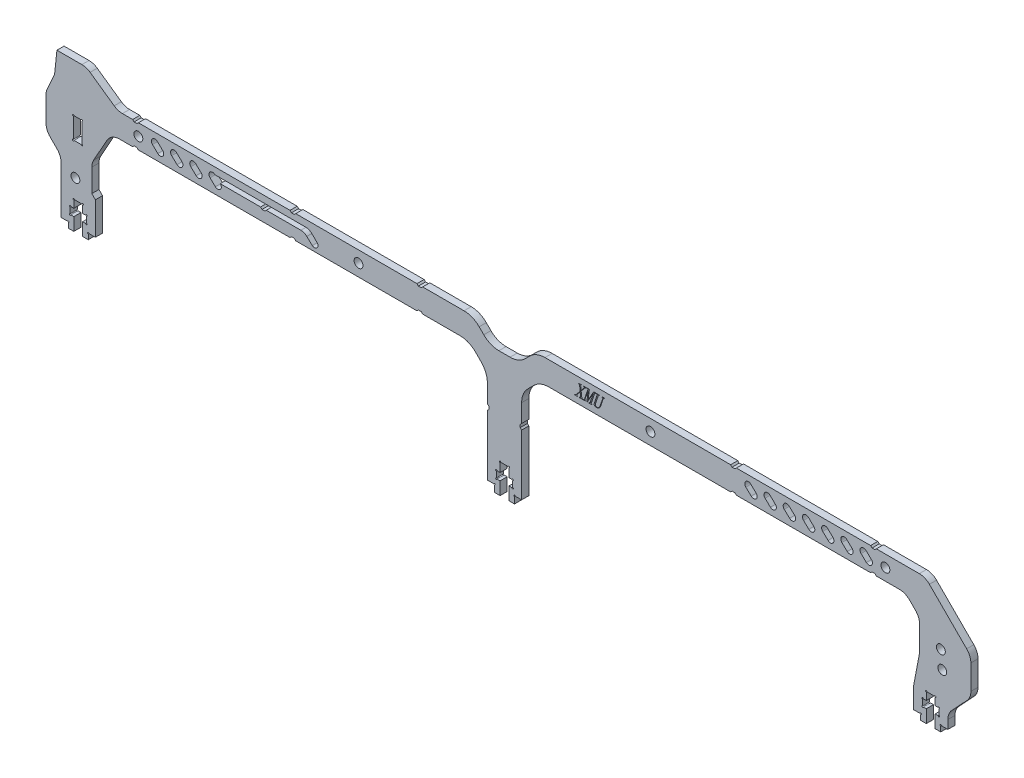
from build123d import *

# Parameters (mm, degrees)
SKETCH_1_R             = 1.55
EXTRUDE_1_DEPTH        = 2.5
CUT_EXTRUDE_START      = 2.5
CUT_EXTRUDE_3496_DEPTH = 174.669400478
SKETCH_5_R             = 1.55
CUT_EXTRUDE_4025_DEPTH = 172.169400478
CUT_EXTRUDE_3_DEPTH    = 172.169400478
SKETCH_4_R             = 1.55
SKETCH_4_W             = 3
SKETCH_4_H             = 7.5
CUT_EXTRUDE_5593_DEPTH = 172.169400605
FILLET_2_R             = 5
FILLET_3_R             = 7.5
SKETCH_6_R             = 0.25
CUT_EXTRUDE_7978_DEPTH = 172.169400605


with BuildPart() as part:
    # 草图1 → 凸台-拉伸1 (new body)
    with BuildSketch(Plane.XY):
        Polygon((6, -16.169651978), (6, -48.75), (3.5, -48.75), (3.5, -51.25), (1.55, -51.25), (1.55, -46.75), (2.85, -46.75), (2.85, -44.25), (1.55, -44.25), (1.55, -41), (-1.55, -41), (-1.55, -44.25), (-2.85, -44.25), (-2.85, -46.75), (-1.55, -46.75), (-1.55, -51.25), (-3.5, -51.25), (-3.5, -48.75), (-6, -48.75), (-6, -16.169651978), (-12.419651978, -9.75), (-137.776793554, -9.75), (-144.5, -21.790224422), (-144.5, -31.126984908), (-143.25, -32.372551033), (-143.25, -43.75), (-145.75, -43.75), (-145.75, -45.75), (-147.7, -45.75), (-147.7, -41.25), (-146.4, -41.25), (-146.4, -38.75), (-147.7, -38.75), (-147.7, -36), (-150.8, -36), (-150.8, -38.75), (-152.1, -38.75), (-152.1, -41.25), (-150.8, -41.25), (-150.8, -45.75), (-152.75, -45.75), (-152.75, -43.75), (-155.25, -43.75), (-155.25, -25.087295918), (-160.547038302, -19.809046738), (-160.547038302, -8.191202609), (-157.535079808, -1.5), (-156.72406497, 6.25), (-146.4, 6.25), (-135.370021316, -1.5), (-11.068526324, -1.5), (-5.068526324, -7.5), (5.068526324, -7.5), (11.068526324, -1.5), (147.321081279, -1.5), (163.297737768, -17.476656488), (163.297737768, -30.163791216), (155.25, -38.75), (155.25, -43.75), (152.75, -43.75), (152.75, -45.75), (150.8, -45.75), (150.8, -41.25), (152.1, -41.25), (152.1, -38.75), (150.8, -38.75), (150.8, -36), (147.7, -36), (147.7, -38.75), (146.4, -38.75), (146.4, -41.25), (147.7, -41.25), (147.7, -45.75), (145.75, -45.75), (145.75, -43.75), (143.25, -43.75), (143.25, -36.430605331), (145.333743048, -25.506490595), (145.333743048, -14.709048804), (140.374694244, -9.75), (12.419651978, -9.75), align=None)
        with Locations((-51.111502481, -5.5)):
            Circle(SKETCH_1_R, mode=Mode.SUBTRACT)
        with Locations((51.111502481, -5.5)):
            Circle(SKETCH_1_R, mode=Mode.SUBTRACT)
    extrude(amount=EXTRUDE_1_DEPTH)

    # 草图2 → Cut-Extrude 3496 (cut, through all)
    with BuildSketch(Plane.XY.offset(CUT_EXTRUDE_START)):
        with BuildLine():
            Line((86.390531446, -7.419671616), (84.526020268, -5.637826132))
            ThreePointArc((84.526020268, -5.637826132), (84.48651997, -3.895480946), (86.228865156, -3.855980648))
            Line((86.228865156, -3.855980648), (88.093376334, -5.637826132))
            ThreePointArc((88.093376334, -5.637826132), (88.132876632, -7.380171319), (86.390531446, -7.419671616))
        make_face()
        with BuildLine():
            Line((106.567114581, -7.394019352), (104.702603403, -5.612173868))
            ThreePointArc((104.702603403, -5.612173868), (104.663103105, -3.869828681), (106.405448291, -3.830328384))
            Line((106.405448291, -3.830328384), (108.269959469, -5.612173868))
            ThreePointArc((108.269959469, -5.612173868), (108.309459767, -7.354519054), (106.567114581, -7.394019352))
        make_face()
        with BuildLine():
            Line((99.825243579, -7.419671616), (97.960732401, -5.637826132))
            ThreePointArc((97.960732401, -5.637826132), (97.920663438, -3.870397346), (99.688092225, -3.830328384))
            Line((99.688092225, -3.830328384), (101.552603403, -5.612173868))
            ThreePointArc((101.552603403, -5.612173868), (101.592672365, -7.379602654), (99.825243579, -7.419671616))
        make_face()
        with BuildLine():
            Line((113.284470648, -7.394019352), (111.41995947, -5.612173868))
            ThreePointArc((111.41995947, -5.612173868), (111.380459172, -3.869828681), (113.122804358, -3.830328384))
            Line((113.122804358, -3.830328384), (114.987315536, -5.612173868))
            ThreePointArc((114.987315536, -5.612173868), (115.026815834, -7.354519054), (113.284470648, -7.394019352))
        make_face()
        with BuildLine():
            Line((120.001826714, -7.394019352), (118.137315536, -5.612173868))
            ThreePointArc((118.137315536, -5.612173868), (118.097815238, -3.869828681), (119.840160424, -3.830328384))
            Line((119.840160424, -3.830328384), (121.704671602, -5.612173868))
            ThreePointArc((121.704671602, -5.612173868), (121.7441719, -7.354519054), (120.001826714, -7.394019352))
        make_face()
        with BuildLine():
            Line((126.71918278, -7.394019352), (124.854671602, -5.612173868))
            ThreePointArc((124.854671602, -5.612173868), (124.814605269, -3.844861024), (126.581918113, -3.80479469))
            Line((126.581918113, -3.80479469), (128.446429291, -5.586640174))
            ThreePointArc((128.446429291, -5.586640174), (128.486495625, -7.353953018), (126.71918278, -7.394019352))
        make_face()
        with BuildLine():
            Line((93.107887512, -7.419671616), (91.243376334, -5.637826132))
            ThreePointArc((91.243376334, -5.637826132), (91.203876036, -3.895480946), (92.946221223, -3.855980648))
            Line((92.946221223, -3.855980648), (94.810732401, -5.637826132))
            ThreePointArc((94.810732401, -5.637826132), (94.850232699, -7.380171319), (93.107887512, -7.419671616))
        make_face()
        with BuildLine():
            Line((-121.405441731, -7.419671616), (-123.26995291, -5.637826132))
            ThreePointArc((-123.26995291, -5.637826132), (-123.309453207, -3.895480946), (-121.567108021, -3.855980648))
            Line((-121.567108021, -3.855980648), (-119.702596843, -5.637826132))
            ThreePointArc((-119.702596843, -5.637826132), (-119.663096545, -7.380171319), (-121.405441731, -7.419671616))
        make_face()
        with BuildLine():
            Line((-107.970729599, -7.419671616), (-109.835240777, -5.637826132))
            ThreePointArc((-109.835240777, -5.637826132), (-109.874741075, -3.895480946), (-108.132395888, -3.855980648))
            Line((-108.132395888, -3.855980648), (-106.26788471, -5.637826132))
            ThreePointArc((-106.26788471, -5.637826132), (-106.228384412, -7.380171319), (-107.970729599, -7.419671616))
        make_face()
        with BuildLine():
            Line((-101.238677177, -7.419671616), (-103.103188356, -5.637826132))
            ThreePointArc((-103.103188356, -5.637826132), (-103.142688653, -3.895480946), (-101.400343467, -3.855980648))
            Line((-101.400343467, -3.855980648), (-69.614914, -3.855980648))
            ThreePointArc((-69.614914, -3.855980648), (-68.498348963, -4.071508971), (-67.542218187, -4.687125635))
            Line((-67.542218187, -4.687125635), (-65.62282749, -6.521417478))
            ThreePointArc((-65.62282749, -6.521417478), (-65.653413324, -8.183052001), (-67.310976024, -8.303262962))
            Line((-67.310976024, -8.303262962), (-69.230366721, -6.468971119))
            ThreePointArc((-69.230366721, -6.468971119), (-70.186497497, -5.853354455), (-71.303062533, -5.637826132))
            Line((-71.303062533, -5.637826132), (-99.535832289, -5.637826132))
            ThreePointArc((-99.535832289, -5.637826132), (-99.496331991, -7.380171319), (-101.238677177, -7.419671616))
        make_face()
        with BuildLine():
            Line((-114.688085665, -7.419671616), (-116.552596843, -5.637826132))
            ThreePointArc((-116.552596843, -5.637826132), (-116.592097141, -3.895480946), (-114.849751955, -3.855980648))
            Line((-114.849751955, -3.855980648), (-112.985240777, -5.637826132))
            ThreePointArc((-112.985240777, -5.637826132), (-112.945740479, -7.380171319), (-114.688085665, -7.419671616))
        make_face()
    extrude(amount=-CUT_EXTRUDE_3496_DEPTH, mode=Mode.SUBTRACT)

    # 草图5 → Cut-Extrude 4025 (cut, through all)
    with BuildSketch(Plane.XY):
        with Locations((-128.203630943, -5.637826132)):
            Circle(SKETCH_5_R)
        with Locations((133.380107324, -5.586640174)):
            Circle(SKETCH_5_R)
    extrude(amount=CUT_EXTRUDE_4025_DEPTH, mode=Mode.SUBTRACT)

    # 草图3 → 切除-拉伸3 (cut, through all)
    with BuildSketch(Plane.XY.offset(2.5)):
        with BuildLine():
            Line((26.842876646, -5.36010218), (27.073934009, -7.183999869))
            add(Edge.make_bspline(
                [(27.073934009, -7.183999869), (27.077891242, -7.206874509), (27.085284313, -7.249609897), (27.10443675, -7.307908144), (27.128693462, -7.355727246), (27.158133773, -7.39401921), (27.194105158, -7.420527551), (27.233086445, -7.44018934), (27.276367892, -7.452449006), (27.306730488, -7.453589397), (27.322275191, -7.454173242)],
                knots=[0, 0, 0, 0, 1.367669835, 2.55513979, 3.602847735, 4.518826173, 5.373590596, 6.213258653, 7.085244148, 8, 8, 8, 8], degree=3))
            Line((27.322275191, -7.454173242), (27.395049164, -7.454173242))
            Line((27.395049164, -7.454173242), (27.335920311, -7.628830776))
            Line((27.335920311, -7.628830776), (26.284336407, -7.628830776))
            Line((26.284336407, -7.628830776), (26.343465259, -7.454173242))
            Line((26.343465259, -7.454173242), (26.441710123, -7.454173242))
            add(Edge.make_bspline(
                [(26.441710123, -7.454173242), (26.460521738, -7.453548985), (26.49463406, -7.452416979), (26.540761642, -7.447060831), (26.576283075, -7.435770422), (26.609106191, -7.414516918), (26.635523971, -7.378528269), (26.648824839, -7.347100755), (26.655483667, -7.331367163)],
                knots=[0, 0, 0, 0, 1.256637502, 2.278742306, 3.091811853, 3.720701099, 4.85891205, 6, 6, 6, 6], degree=3))
            add(Edge.make_bspline(
                [(26.655483667, -7.331367163), (26.660199712, -7.315091139), (26.669522654, -7.282915776), (26.666214919, -7.249590074), (26.664580414, -7.2331223)],
                knots=[0, 0, 0, 0, 1.01170729, 2, 2, 2, 2], degree=3))
            Line((26.664580414, -7.2331223), (26.503567999, -5.787649269))
            Line((26.503567999, -5.787649269), (25.54477091, -6.963858602))
            add(Edge.make_bspline(
                [(25.54477091, -6.963858602), (25.53046492, -6.983225858), (25.503508689, -7.019718842), (25.466126854, -7.072028776), (25.433281979, -7.117646627), (25.414286021, -7.14693958), (25.405590688, -7.160348328)],
                knots=[0, 0, 0, 0, 1.199723082, 2.260592496, 3.203792235, 4, 4, 4, 4], degree=3))
            add(Edge.make_bspline(
                [(25.405590688, -7.160348328), (25.393275513, -7.174762738), (25.37126232, -7.200528287), (25.344801462, -7.235992154), (25.325012121, -7.261161829), (25.317506944, -7.276392598), (25.314623222, -7.282244732)],
                knots=[0, 0, 0, 0, 1.491520878, 2.666071737, 3.487463387, 4, 4, 4, 4], degree=3))
            add(Edge.make_bspline(
                [(25.314623222, -7.282244732), (25.31047408, -7.29727475), (25.303012655, -7.324303317), (25.29956769, -7.363158804), (25.308746807, -7.395573044), (25.329314901, -7.419837024), (25.358501001, -7.434427245), (25.391965998, -7.446685634), (25.432108886, -7.45231837), (25.460468235, -7.45352689), (25.475635636, -7.454173242)],
                knots=[0, 0, 0, 0, 1.258149697, 2.262537764, 3.106246448, 3.905123956, 4.74883264, 5.708409484, 6.774391054, 8, 8, 8, 8], degree=3))
            Line((25.475635636, -7.454173242), (25.523848393, -7.454173242))
            Line((25.523848393, -7.454173242), (25.46471954, -7.628830776))
            Line((25.46471954, -7.628830776), (24.541399763, -7.628830776))
            Line((24.541399763, -7.628830776), (24.600528616, -7.454173242))
            Line((24.600528616, -7.454173242), (24.697863804, -7.454173242))
            add(Edge.make_bspline(
                [(24.697863804, -7.454173242), (24.718247519, -7.453263201), (24.759461621, -7.451423178), (24.821211221, -7.437243928), (24.88225794, -7.412934934), (24.962603681, -7.370476752), (25.055554767, -7.305763694), (25.116711031, -7.240279696), (25.14633341, -7.208561084)],
                knots=[0, 0, 0, 0, 0.697204109, 1.409686196, 2.155472362, 2.939893483, 4.517770228, 6, 6, 6, 6], degree=3))
            Line((25.14633341, -7.208561084), (26.481735807, -5.565688653))
            Line((26.481735807, -5.565688653), (26.280697708, -3.725416821))
            add(Edge.make_bspline(
                [(26.280697708, -3.725416821), (26.280319145, -3.713514063), (26.279588291, -3.69053462), (26.269758921, -3.657936892), (26.25516688, -3.628016442), (26.234034679, -3.601750054), (26.207175322, -3.57877827), (26.172163385, -3.563550562), (26.130757164, -3.554595318), (26.100937117, -3.553872019), (26.085117657, -3.553488311)],
                knots=[0, 0, 0, 0, 0.963274239, 1.859695545, 2.740763114, 3.652279572, 4.579299683, 5.58205851, 6.717288088, 8, 8, 8, 8], degree=3))
            Line((26.085117657, -3.553488311), (25.98414377, -3.553488311))
            Line((25.98414377, -3.553488311), (26.044182297, -3.378830776))
            Line((26.044182297, -3.378830776), (27.062108239, -3.378830776))
            Line((27.062108239, -3.378830776), (27.002069712, -3.553488311))
            Line((27.002069712, -3.553488311), (26.928386064, -3.553488311))
            add(Edge.make_bspline(
                [(26.928386064, -3.553488311), (26.905876153, -3.554225198), (26.864301474, -3.555586193), (26.807179142, -3.568641848), (26.761846198, -3.592228332), (26.728381928, -3.626560042), (26.707250439, -3.670215141), (26.691911533, -3.721517495), (26.681745378, -3.781730787), (26.681229175, -3.825133073), (26.680954557, -3.8482229)],
                knots=[0, 0, 0, 0, 1.204056817, 2.223832611, 3.110037804, 3.90218494, 4.7444789, 5.679028617, 6.765253396, 8, 8, 8, 8], degree=3))
            Line((26.680954557, -3.8482229), (26.816496081, -5.152696358))
            Line((26.816496081, -5.152696358), (27.817138205, -3.897345331))
            add(Edge.make_bspline(
                [(27.817138205, -3.897345331), (27.836557847, -3.870592091), (27.871798849, -3.822042742), (27.915399468, -3.752993302), (27.941303309, -3.693235286), (27.955201066, -3.644196593), (27.950827226, -3.600239404), (27.919300429, -3.570689133), (27.872138453, -3.555372529), (27.835476999, -3.554175941), (27.814409181, -3.553488311)],
                knots=[0, 0, 0, 0, 1.657133816, 3.007215952, 4.08279459, 4.908639271, 5.555730562, 6.168353614, 6.94742873, 8, 8, 8, 8], degree=3))
            Line((27.814409181, -3.553488311), (27.670680585, -3.553488311))
            Line((27.670680585, -3.553488311), (27.730719112, -3.378830776))
            Line((27.730719112, -3.378830776), (28.664045311, -3.378830776))
            Line((28.664045311, -3.378830776), (28.604006783, -3.553488311))
            Line((28.604006783, -3.553488311), (28.464826561, -3.553488311))
            add(Edge.make_bspline(
                [(28.464826561, -3.553488311), (28.456283106, -3.554092671), (28.436987589, -3.555457629), (28.406142358, -3.565533072), (28.370421636, -3.581423082), (28.313458698, -3.612047749), (28.23421411, -3.665758005), (28.175678885, -3.720229732), (28.143711407, -3.749978037)],
                knots=[0, 0, 0, 0, 0.401790055, 0.907448668, 1.514467097, 2.242134241, 3.947740196, 6, 6, 6, 6], degree=3))
            Line((28.143711407, -3.749978037), (26.842876646, -5.36010218))
        make_face()
        with BuildLine():
            add(Edge.make_bspline(
                [(30.372414318, -7.257683516), (30.36780328, -7.273007673), (30.359420895, -7.300865388), (30.35695855, -7.34205227), (30.364624266, -7.377584995), (30.38333672, -7.406382131), (30.409377572, -7.42899286), (30.443710061, -7.442566793), (30.483022159, -7.453524431), (30.511800755, -7.453948436), (30.527059009, -7.454173242)],
                knots=[0, 0, 0, 0, 1.23478593, 2.2447118, 3.160904251, 3.994027648, 4.859237073, 5.783504496, 6.824826152, 8, 8, 8, 8], degree=3))
            Line((30.527059009, -7.454173242), (30.625303873, -7.454173242))
            Line((30.625303873, -7.454173242), (30.56617502, -7.628830776))
            Line((30.56617502, -7.628830776), (29.502765345, -7.628830776))
            Line((29.502765345, -7.628830776), (29.561894198, -7.454173242))
            Line((29.561894198, -7.454173242), (29.681971253, -7.454173242))
            add(Edge.make_bspline(
                [(29.681971253, -7.454173242), (29.700848836, -7.453929649), (29.736784348, -7.453465944), (29.786620413, -7.442523783), (29.830960241, -7.429251025), (29.867082994, -7.405852359), (29.899330966, -7.378372195), (29.924751742, -7.343004616), (29.948845697, -7.303406709), (29.959366112, -7.273406975), (29.964880071, -7.257683516)],
                knots=[0, 0, 0, 0, 1.207434187, 2.298480843, 3.264247985, 4.155013055, 5.037027136, 5.966864655, 6.934393254, 8, 8, 8, 8], degree=3))
            Line((29.964880071, -7.257683516), (31.057399335, -4.043802951))
            Line((31.057399335, -4.043802951), (31.009186578, -4.043802951))
            Line((31.009186578, -4.043802951), (28.973334694, -7.628830776))
            Line((28.973334694, -7.628830776), (28.828696424, -7.628830776))
            Line((28.828696424, -7.628830776), (29.274437006, -4.122944646))
            Line((29.274437006, -4.122944646), (29.226224249, -4.122944646))
            Line((29.226224249, -4.122944646), (28.160085551, -7.258593191))
            add(Edge.make_bspline(
                [(28.160085551, -7.258593191), (28.155454253, -7.273614243), (28.146874481, -7.301441692), (28.144806319, -7.342289958), (28.151532997, -7.377640143), (28.169111336, -7.406654748), (28.195108067, -7.42868641), (28.228574098, -7.442641442), (28.267054768, -7.453510479), (28.295230008, -7.453943467), (28.310181869, -7.454173242)],
                knots=[0, 0, 0, 0, 1.228525151, 2.275920474, 3.17610773, 4.008063952, 4.88502281, 5.800162296, 6.83260377, 8, 8, 8, 8], degree=3))
            Line((28.310181869, -7.454173242), (28.382046167, -7.454173242))
            Line((28.382046167, -7.454173242), (28.322917314, -7.628830776))
            Line((28.322917314, -7.628830776), (27.565158325, -7.628830776))
            Line((27.565158325, -7.628830776), (27.624287177, -7.454173242))
            Line((27.624287177, -7.454173242), (27.697970825, -7.454173242))
            add(Edge.make_bspline(
                [(27.697970825, -7.454173242), (27.717459248, -7.453975813), (27.754008474, -7.453605548), (27.80471772, -7.442399361), (27.849593667, -7.429211042), (27.886650964, -7.40617722), (27.918888325, -7.37806063), (27.945418498, -7.343336157), (27.969332595, -7.303358016), (27.979893064, -7.27339023), (27.985428016, -7.257683516)],
                knots=[0, 0, 0, 0, 1.233062462, 2.312525696, 3.286277956, 4.184033181, 5.056683097, 5.988450042, 6.945706586, 8, 8, 8, 8], degree=3))
            Line((27.985428016, -7.257683516), (29.178011492, -3.749978037))
            add(Edge.make_bspline(
                [(29.178011492, -3.749978037), (29.182706291, -3.734640837), (29.191332148, -3.70646146), (29.196968949, -3.665670381), (29.192411351, -3.630980251), (29.180538613, -3.601147103), (29.156503815, -3.57774655), (29.121060961, -3.563133441), (29.075649539, -3.554407329), (29.041914366, -3.553814337), (29.023366801, -3.553488311)],
                knots=[0, 0, 0, 0, 1.198751147, 2.202491997, 3.048772216, 3.789863414, 4.559186991, 5.482130385, 6.615677689, 8, 8, 8, 8], degree=3))
            Line((29.023366801, -3.553488311), (28.925121938, -3.553488311))
            Line((28.925121938, -3.553488311), (28.985160465, -3.378830776))
            Line((28.985160465, -3.378830776), (29.720177588, -3.378830776))
            Line((29.720177588, -3.378830776), (29.298998222, -6.670033687))
            Line((29.298998222, -6.670033687), (29.347210979, -6.670033687))
            Line((29.347210979, -6.670033687), (31.212044027, -3.378830776))
            Line((31.212044027, -3.378830776), (32.010738376, -3.378830776))
            Line((32.010738376, -3.378830776), (31.950699849, -3.553488311))
            Line((31.950699849, -3.553488311), (31.852454986, -3.553488311))
            add(Edge.make_bspline(
                [(31.852454986, -3.553488311), (31.836330295, -3.553883055), (31.805014907, -3.554649678), (31.759140886, -3.564499234), (31.715709259, -3.579481742), (31.675583293, -3.601511031), (31.63941886, -3.629151055), (31.608036284, -3.662922389), (31.583276356, -3.704104591), (31.571237405, -3.734318574), (31.564997794, -3.749978037)],
                knots=[0, 0, 0, 0, 1.033896186, 2.007905892, 2.999668424, 3.975817745, 4.93412292, 5.912794845, 6.918232267, 8, 8, 8, 8], degree=3))
            Line((31.564997794, -3.749978037), (30.372414318, -7.257683516))
        make_face()
        with BuildLine():
            add(Edge.make_bspline(
                [(32.314569712, -7.454173242), (32.343719248, -7.453537342), (32.402258872, -7.452260295), (32.489294401, -7.439879801), (32.575605894, -7.420516492), (32.661362641, -7.394427593), (32.746117669, -7.359054771), (32.830901496, -7.317837703), (32.913761475, -7.266706783), (32.996066873, -7.210404029), (33.073981461, -7.147150159), (33.147533495, -7.080381906), (33.21515984, -7.009814956), (33.274710949, -6.933908743), (33.329261343, -6.855340771), (33.376254127, -6.77234027), (33.417727101, -6.685829412), (33.439712557, -6.625657763), (33.450753359, -6.595440365)],
                knots=[0, 0, 0, 0, 0.92461968, 1.856869641, 2.783740041, 3.730381685, 4.697156597, 5.695597242, 6.718818904, 7.783901478, 8.858462412, 9.900649596, 10.93530124, 11.955758841, 12.959379979, 13.96797139, 14.979542399, 16, 16, 16, 16], degree=3))
            Line((33.450753359, -6.595440365), (34.41773752, -3.749978037))
            add(Edge.make_bspline(
                [(34.41773752, -3.749978037), (34.422432318, -3.734640837), (34.431058176, -3.70646146), (34.436694977, -3.665670381), (34.432137378, -3.630980251), (34.42026464, -3.601147103), (34.396229842, -3.57774655), (34.360786988, -3.563133441), (34.315375566, -3.554407329), (34.281640394, -3.553814337), (34.263092828, -3.553488311)],
                knots=[0, 0, 0, 0, 1.198751147, 2.202491997, 3.048772216, 3.789863414, 4.559186991, 5.482130385, 6.615677689, 8, 8, 8, 8], degree=3))
            Line((34.263092828, -3.553488311), (34.115725533, -3.553488311))
            Line((34.115725533, -3.553488311), (34.175764061, -3.378830776))
            Line((34.175764061, -3.378830776), (35.087258068, -3.378830776))
            Line((35.087258068, -3.378830776), (35.02721954, -3.553488311))
            Line((35.02721954, -3.553488311), (34.879852246, -3.553488311))
            add(Edge.make_bspline(
                [(34.879852246, -3.553488311), (34.863727496, -3.553883018), (34.832411993, -3.554649571), (34.786538801, -3.564499636), (34.743104026, -3.579480214), (34.702989621, -3.601516591), (34.666782651, -3.629130535), (34.635738549, -3.662811262), (34.610413734, -3.703333558), (34.598578238, -3.733374275), (34.592395054, -3.749068362)],
                knots=[0, 0, 0, 0, 1.036039185, 2.01206776, 3.005885959, 3.984058584, 4.944350078, 5.925050536, 6.915990043, 8, 8, 8, 8], degree=3))
            Line((34.592395054, -3.749068362), (33.630868941, -6.579066221))
            add(Edge.make_bspline(
                [(33.630868941, -6.579066221), (33.616411146, -6.619077295), (33.587887291, -6.698015336), (33.5331776, -6.810549705), (33.47165494, -6.916797936), (33.402197927, -7.017054295), (33.323564422, -7.109591586), (33.237818164, -7.196273026), (33.14453098, -7.277110395), (33.043546709, -7.349616897), (32.938661992, -7.41410071), (32.834063416, -7.472148088), (32.729407299, -7.520330495), (32.624838192, -7.559851595), (32.520609623, -7.590866757), (32.416290039, -7.61291398), (32.312474057, -7.625901363), (32.243346517, -7.627859303), (32.209047451, -7.628830776)],
                knots=[0, 0, 0, 0, 1.086251029, 2.143069963, 3.191422009, 4.220826023, 5.254390086, 6.289723628, 7.333342165, 8.404123815, 9.461794222, 10.47761212, 11.458565434, 12.402446991, 13.331460314, 14.233964707, 15.123744872, 16, 16, 16, 16], degree=3))
            add(Edge.make_bspline(
                [(32.209047451, -7.628830776), (32.173835111, -7.628255457), (32.105019354, -7.627131106), (32.004659201, -7.614758488), (31.910225712, -7.596140236), (31.821693661, -7.569727688), (31.739562054, -7.534844224), (31.66285114, -7.493119385), (31.59208139, -7.44367985), (31.528329002, -7.386469491), (31.472231937, -7.321171828), (31.431306878, -7.24435017), (31.403914289, -7.158983834), (31.389483366, -7.064789642), (31.389165797, -6.961631791), (31.403060213, -6.849604988), (31.428161507, -6.728530655), (31.454714327, -6.646460147), (31.46857228, -6.603627437)],
                knots=[0, 0, 0, 0, 1.077740137, 2.106236129, 3.091401989, 4.022578999, 4.929695852, 5.818958484, 6.692225263, 7.566675998, 8.436926303, 9.313592649, 10.212114664, 11.170801188, 12.220086199, 13.360332549, 14.622353996, 16, 16, 16, 16], degree=3))
            Line((31.46857228, -6.603627437), (32.438285465, -3.749068362))
            add(Edge.make_bspline(
                [(32.438285465, -3.749068362), (32.442970985, -3.733730563), (32.451491778, -3.705838201), (32.457255285, -3.665373246), (32.4526741, -3.630979314), (32.440815525, -3.601147348), (32.416776815, -3.577746469), (32.381335282, -3.56313347), (32.335923392, -3.554407319), (32.302188297, -3.553814333), (32.283640773, -3.553488311)],
                knots=[0, 0, 0, 0, 1.202134876, 2.186127305, 3.034796328, 3.777979413, 4.549474568, 5.475023165, 6.611770146, 8, 8, 8, 8], degree=3))
            Line((32.283640773, -3.553488311), (32.160834694, -3.553488311))
            Line((32.160834694, -3.553488311), (32.220873222, -3.378830776))
            Line((32.220873222, -3.378830776), (33.316121509, -3.378830776))
            Line((33.316121509, -3.378830776), (33.256082982, -3.553488311))
            Line((33.256082982, -3.553488311), (33.133276903, -3.553488311))
            add(Edge.make_bspline(
                [(33.133276903, -3.553488311), (33.117152213, -3.553883055), (33.085836824, -3.554649678), (33.039962804, -3.564499234), (32.996531176, -3.579481742), (32.956405211, -3.601511031), (32.920240777, -3.629151055), (32.888858201, -3.662922389), (32.864098274, -3.704104591), (32.852059323, -3.734318574), (32.845819712, -3.749978037)],
                knots=[0, 0, 0, 0, 1.033896186, 2.007905892, 2.999668424, 3.975817745, 4.93412292, 5.912794845, 6.918232267, 8, 8, 8, 8], degree=3))
            Line((32.845819712, -3.749978037), (31.870648479, -6.620001581))
            add(Edge.make_bspline(
                [(31.870648479, -6.620001581), (31.857712612, -6.658965853), (31.83304842, -6.733257146), (31.805804218, -6.841182886), (31.788005159, -6.939079029), (31.779468607, -7.02701114), (31.77912877, -7.105655332), (31.790806049, -7.174536649), (31.8117446, -7.233617999), (31.84226222, -7.283279339), (31.882175354, -7.323069125), (31.925550175, -7.359535698), (31.976867757, -7.388219795), (32.032970698, -7.4132038), (32.095633507, -7.430692353), (32.163348807, -7.444650891), (32.237055893, -7.452699841), (32.288170413, -7.453671438), (32.314569712, -7.454173242)],
                knots=[0, 0, 0, 0, 1.636166812, 3.119600182, 4.433209101, 5.598709846, 6.638316257, 7.558406415, 8.369089041, 9.12376768, 9.859029478, 10.606608075, 11.375765131, 12.193178508, 13.049951869, 13.962627932, 14.947751197, 16, 16, 16, 16], degree=3))
        make_face()
    extrude(amount=-CUT_EXTRUDE_3_DEPTH, mode=Mode.SUBTRACT)

    # 草图4 → Cut-Extrude 5593 (cut, through all)
    with BuildSketch(Plane.XY):
        with Locations((-150.25, -29.25)):
            Circle(SKETCH_4_R)
        with Locations((152.797585241, -20.675)):
            Circle(SKETCH_4_R)
        with Locations((153.297585241, -26.654130372)):
            Circle(SKETCH_4_R)
        Polygon((-6, -25.591037506), (-5.5, -26.091037506), (-5.5, -27.091037506), (-6, -27.591037506), align=None)
        Polygon((6, -27.591037506), (6, -25.591037506), (5.5, -26.091037506), (5.5, -27.091037506), align=None)
        Polygon((-128.205066765, -1.5), (-130.205066765, -1.5), (-129.705066765, -2), (-128.705066765, -2), align=None)
        Polygon((130.205066765, -1.5), (129.705066765, -2), (128.705066765, -2), (128.205066765, -1.5), align=None)
        Polygon((-130.205066765, -9.75), (-129.705066765, -9.25), (-128.705066765, -9.25), (-128.205066765, -9.75), align=None)
        Polygon((-73.098222766, -1.5), (-75.098222766, -1.5), (-74.598222766, -2), (-73.598222766, -2), align=None)
        Polygon((-75.098222766, -9.75), (-74.598222766, -9.25), (-73.598222766, -9.25), (-73.098222766, -9.75), align=None)
        Polygon((-28.652309606, -1.5), (-30.652309606, -1.5), (-30.152309606, -2), (-29.152309606, -2), align=None)
        Polygon((-30.652309606, -9.75), (-30.152309606, -9.25), (-29.152309606, -9.25), (-28.652309606, -9.75), align=None)
        Polygon((-83.419447411, -5.637826132), (-85.419447411, -5.637826132), (-84.919447411, -6.137826132), (-83.919447411, -6.137826132), align=None)
        Polygon((79.182303802, -9.75), (81.182303802, -9.75), (80.682303802, -9.25), (79.682303802, -9.25), align=None)
        Polygon((128.205066765, -9.75), (130.205066765, -9.75), (129.705066765, -9.25), (128.705066765, -9.25), align=None)
        with Locations((-149.5, -14.375)):
            Rectangle(SKETCH_4_W, SKETCH_4_H)
        Polygon((81.182303802, -1.5), (80.682303802, -2), (79.682303802, -2), (79.194803802, -1.5), align=None)
    extrude(amount=CUT_EXTRUDE_5593_DEPTH, mode=Mode.SUBTRACT)

    # 圆角2
    fillet_2_edges = [part.edges().sort_by_distance(p)[0] for p in [
        (-137.776793554, -9.75, 1.25),
        (-144.5, -21.790224422, 1.25),
        (-155.25, -25.087295918, 1.25),
        (-160.547038302, -19.809046738, 1.25),
        (-160.547038302, -8.191202609, 1.25),
        (-157.535079808, -1.5, 1.25),
        (-146.4, 6.25, 1.25),
        (-135.370021316, -1.5, 1.25),
        (147.321081279, -1.5, 1.25),
        (163.297737768, -17.476656488, 1.25),
        (163.297737768, -30.163791216, 1.25),
        (155.25, -38.75, 1.25),
        (143.25, -36.430605331, 1.25),
        (145.333743048, -25.506490595, 1.25),
        (145.333743048, -14.709048804, 1.25),
        (140.374694244, -9.75, 1.25),
    ]]
    fillet(fillet_2_edges, radius=FILLET_2_R)

    # 圆角3
    fillet_3_edges = [part.edges().sort_by_distance(p)[0] for p in [
        (-6, -16.169651978, 1.25),
        (-12.419651978, -9.75, 1.25),
        (-11.068526324, -1.5, 1.25),
        (-5.068526324, -7.5, 1.25),
        (5.068526324, -7.5, 1.25),
        (11.068526324, -1.5, 1.25),
        (12.419651978, -9.75, 1.25),
        (6, -16.169651978, 1.25),
    ]]
    fillet(fillet_3_edges, radius=FILLET_3_R)

    # 草图6 → Cut-Extrude 7978 (cut, through all)
    with BuildSketch(Plane.XY.offset(2.5)):
        with Locations((-151, -10.625)):
            Circle(SKETCH_6_R)
        with Locations((-148, -10.625)):
            Circle(SKETCH_6_R)
        with Locations((-151, -18.125)):
            Circle(SKETCH_6_R)
        with Locations((-148, -18.125)):
            Circle(SKETCH_6_R)
        with Locations((-150.8, -36)):
            Circle(SKETCH_6_R)
        with Locations((-147.7, -36)):
            Circle(SKETCH_6_R)
        with Locations((-152.1, -38.75)):
            Circle(SKETCH_6_R)
        with Locations((-152.1, -41.25)):
            Circle(SKETCH_6_R)
        with Locations((-146.4, -38.75)):
            Circle(SKETCH_6_R)
        with Locations((-146.4, -41.25)):
            Circle(SKETCH_6_R)
        with Locations((-2.85, -44.25)):
            Circle(SKETCH_6_R)
        with Locations((-2.85, -46.75)):
            Circle(SKETCH_6_R)
        with Locations((-1.55, -41)):
            Circle(SKETCH_6_R)
        with Locations((-3.5, -48.75)):
            Circle(SKETCH_6_R)
        with Locations((-152.75, -43.75)):
            Circle(SKETCH_6_R)
        with Locations((-145.75, -43.75)):
            Circle(SKETCH_6_R)
        with Locations((145.75, -43.75)):
            Circle(SKETCH_6_R)
        with Locations((152.75, -43.75)):
            Circle(SKETCH_6_R)
        with Locations((3.5, -48.75)):
            Circle(SKETCH_6_R)
        with Locations((1.55, -41)):
            Circle(SKETCH_6_R)
        with Locations((2.85, -46.75)):
            Circle(SKETCH_6_R)
        with Locations((2.85, -44.25)):
            Circle(SKETCH_6_R)
        with Locations((146.4, -41.25)):
            Circle(SKETCH_6_R)
        with Locations((146.4, -38.75)):
            Circle(SKETCH_6_R)
        with Locations((152.1, -41.25)):
            Circle(SKETCH_6_R)
        with Locations((152.1, -38.75)):
            Circle(SKETCH_6_R)
        with Locations((147.7, -36)):
            Circle(SKETCH_6_R)
        with Locations((150.8, -36)):
            Circle(SKETCH_6_R)
    extrude(amount=-CUT_EXTRUDE_7978_DEPTH, mode=Mode.SUBTRACT)


solid = part.part
